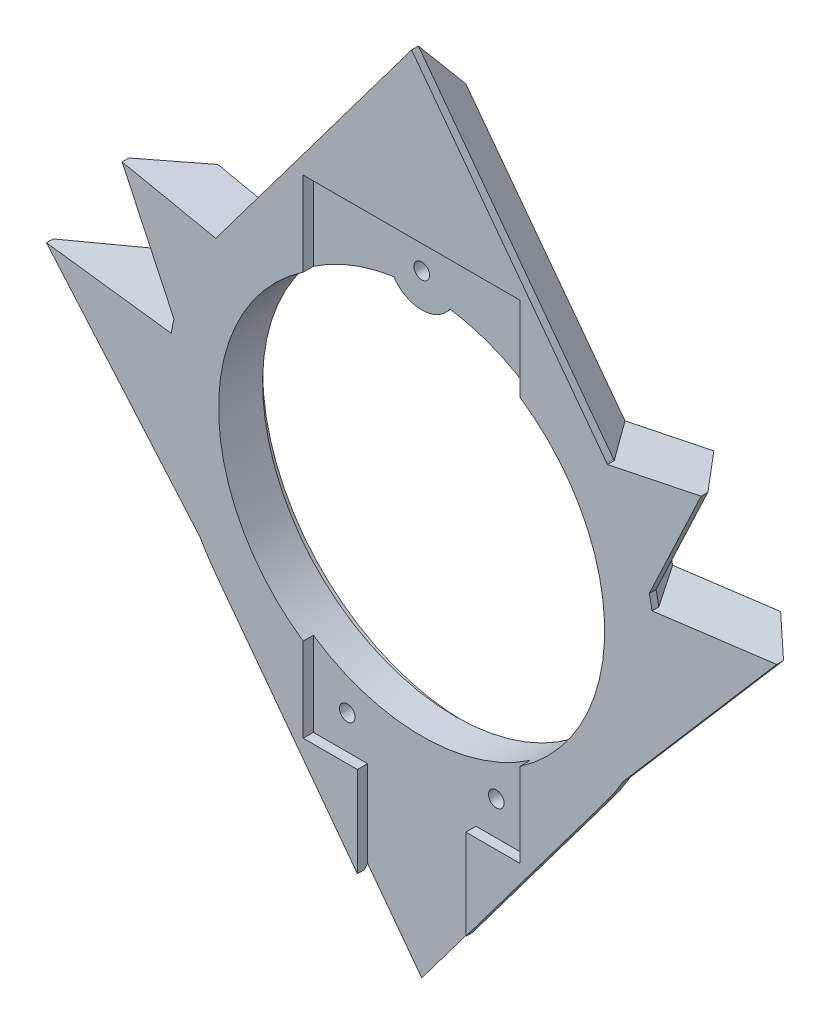
from build123d import *
from OCP.BRepFilletAPI import BRepFilletAPI_MakeChamfer

# Parameters (mm, degrees)
EXTRUDE_1_DEPTH         = 8
CHAMFER_12_SIZE         = 7
CHAMFER_12_SIZE2        = 5
HOLE_WIZARD_M2_22_D     = 2.3
HOLE_WIZARD_M2_22_DEPTH = 3.5
HOLE_WIZARD_M2_22_TIP   = 0.690989712
SKETCH_11_R             = 30
CUT_EXTRUDE_1_DEPTH     = 1.5
EXTRUDE_5_DEPTH         = 8
EXTRUDE_5_2_DEPTH       = 8
EXTRUDE_5_3_DEPTH       = 8
EXTRUDE_5_4_DEPTH       = 8
CHAMFER_13_SIZE         = 5
CHAMFER_13_SIZE2        = 7
CHAMFER_14_SIZE         = 5
CHAMFER_14_SIZE2        = 7
CHAMFER_15_SIZE         = 7
CHAMFER_15_SIZE2        = 5
CHAMFER_16_SIZE         = 5
CHAMFER_16_SIZE2        = 7
SKETCH_23_W             = 32
SKETCH_23_H             = 72
CUT_EXTRUDE_7_DEPTH     = 1.5
SKETCH_13_W             = 16
SKETCH_13_H             = 24
CUT_EXTRUDE_2_DEPTH     = 1.5


with BuildPart() as part:
    # Эскиз1 → Бобышка-Вытянуть1 (new body)
    with BuildSketch(Plane.XY):
        with BuildLine():
            Line((28.8, 21.6), (0, 60))
            Line((0, 60), (-28.8, 21.6))
            ThreePointArc((-28.8, 21.6), (-36, 0), (-28.8, -21.6))
            Line((-28.8, -21.6), (0, -60))
            Line((0, -60), (28.8, -21.6))
            ThreePointArc((28.8, -21.6), (36, 0), (28.8, 21.6))
        make_face()
        with BuildLine():
            ThreePointArc((4.1408267, 28.197580645), (0, -28.5), (-4.1408267, 28.197580645))
            ThreePointArc((-4.1408267, 28.197580645), (0, 26), (4.1408267, 28.197580645))
        make_face(mode=Mode.SUBTRACT)
    extrude(amount=EXTRUDE_1_DEPTH)

    # Фаска12: one chamfer whose edges measure the first distance from different faces: ONE call of the kernel's chamfer builder (chamfer() names one face for all edges)
    chamfer_12_edges_1 = [part.edges().sort_by_distance(p)[0] for p in [
        (14.4, 40.8, 0),
    ]]
    chamfer_12_side_1 = [part.faces().sort_by_distance(p)[0] for p in [
        (14.4, 40.8, 4),
    ]]
    chamfer_12_edges_2 = [part.edges().sort_by_distance(p)[0] for p in [
        (36, 0, 0),
    ]]
    chamfer_12_side_2 = [part.faces().sort_by_distance(p)[0] for p in [
        (36, 0, 4),
    ]]
    chamfer_12_edges_3 = [part.edges().sort_by_distance(p)[0] for p in [
        (14.4, -40.8, 0),
    ]]
    chamfer_12_side_3 = [part.faces().sort_by_distance(p)[0] for p in [
        (14.4, -40.8, 4),
    ]]
    chamfer_12_edges_4 = [part.edges().sort_by_distance(p)[0] for p in [
        (-14.4, -40.8, 0),
    ]]
    chamfer_12_side_4 = [part.faces().sort_by_distance(p)[0] for p in [
        (-14.4, -40.8, 4),
    ]]
    chamfer_12_edges_5 = [part.edges().sort_by_distance(p)[0] for p in [
        (-36, 0, 0),
    ]]
    chamfer_12_side_5 = [part.faces().sort_by_distance(p)[0] for p in [
        (-36, 0, 4),
    ]]
    chamfer_12_edges_6 = [part.edges().sort_by_distance(p)[0] for p in [
        (-14.4, 40.8, 0),
    ]]
    chamfer_12_side_6 = [part.faces().sort_by_distance(p)[0] for p in [
        (-14.4, 40.8, 4),
    ]]
    chamfer_12 = BRepFilletAPI_MakeChamfer(part.part.solid().wrapped)
    for e in chamfer_12_edges_1:
        chamfer_12.Add(CHAMFER_12_SIZE, CHAMFER_12_SIZE2, e.wrapped, chamfer_12_side_1[0].wrapped)  # the first distance lies on this face
    for e in chamfer_12_edges_2:
        chamfer_12.Add(CHAMFER_12_SIZE, CHAMFER_12_SIZE2, e.wrapped, chamfer_12_side_2[0].wrapped)  # the first distance lies on this face
    for e in chamfer_12_edges_3:
        chamfer_12.Add(CHAMFER_12_SIZE, CHAMFER_12_SIZE2, e.wrapped, chamfer_12_side_3[0].wrapped)  # the first distance lies on this face
    for e in chamfer_12_edges_4:
        chamfer_12.Add(CHAMFER_12_SIZE, CHAMFER_12_SIZE2, e.wrapped, chamfer_12_side_4[0].wrapped)  # the first distance lies on this face
    for e in chamfer_12_edges_5:
        chamfer_12.Add(CHAMFER_12_SIZE, CHAMFER_12_SIZE2, e.wrapped, chamfer_12_side_5[0].wrapped)  # the first distance lies on this face
    for e in chamfer_12_edges_6:
        chamfer_12.Add(CHAMFER_12_SIZE, CHAMFER_12_SIZE2, e.wrapped, chamfer_12_side_6[0].wrapped)  # the first distance lies on this face
    add(Compound.cast(chamfer_12.Shape()), mode=Mode.REPLACE)

    # Hole Wizard M2.22
    with Locations(Plane.XY.offset(8)):
        with Locations((0, 31), (-11, -31), (11, -31)):
            Hole(HOLE_WIZARD_M2_22_D / 2, depth=HOLE_WIZARD_M2_22_DEPTH)
            with Locations((0, 0, -(HOLE_WIZARD_M2_22_DEPTH + HOLE_WIZARD_M2_22_TIP / 2))):  # 118° drill point
                Cone(0, HOLE_WIZARD_M2_22_D / 2, HOLE_WIZARD_M2_22_TIP, mode=Mode.SUBTRACT)

    # Эскиз11 → Вырез-Вытянуть1 (cut)
    with BuildSketch(Plane(origin=(0, 0, 0), x_dir=(-1, 0, 0), z_dir=(0, 0, -1))):
        Circle(SKETCH_11_R)
    extrude(amount=-CUT_EXTRUDE_1_DEPTH, mode=Mode.SUBTRACT)


with BuildPart() as body_2:
    # Эскиз17 → Бобышка-Вытянуть5 (new body)
    with BuildSketch(Plane(origin=(0, 0, 8), x_dir=(-1, 0, 0), z_dir=(0, 0, -1))):
        with BuildLine():
            Line((25.238858928, -18), (28.902564257, -20.612903226))
            Line((28.902564257, -20.612903226), (53.902564257, 8.387096774))
            Line((53.902564257, 8.387096774), (30.528334189, 5.387096774))
            ThreePointArc((30.528334189, 5.387096774), (30.236303195, -6.838564841), (25.238858928, -18))
        make_face()
    extrude(amount=EXTRUDE_5_DEPTH)

    # Фаска13
    chamfer_13_edges = [body_2.edges().sort_by_distance(p)[0] for p in [
        (-41.402564257, -6.112903226, 0),
    ]]
    chamfer_13_side = [body_2.faces().sort_by_distance(p)[0] for p in [
        (-37.369612162, -3.153009871, 0),
    ]]
    chamfer(chamfer_13_edges, length=CHAMFER_13_SIZE, length2=CHAMFER_13_SIZE2, reference=chamfer_13_side[0])


with BuildPart() as body_3:
    # Эскиз17 → Extrude 5 2 (new body)
    with BuildSketch(Plane(origin=(0, 0, 8), x_dir=(-1, 0, 0), z_dir=(0, 0, -1))):
        with BuildLine():
            Line((-28.902564257, -20.612903226), (-25.238858928, -18))
            ThreePointArc((-25.238858928, -18), (-30.236303195, -6.838564841), (-30.528334189, 5.387096774))
            Line((-30.528334189, 5.387096774), (-53.902564257, 8.387096774))
            Line((-53.902564257, 8.387096774), (-28.902564257, -20.612903226))
        make_face()
    extrude(amount=EXTRUDE_5_2_DEPTH)

    # Фаска14
    chamfer_14_edges = [body_3.edges().sort_by_distance(p)[0] for p in [
        (41.402564257, -6.112903226, 0),
    ]]
    chamfer_14_side = [body_3.faces().sort_by_distance(p)[0] for p in [
        (37.369612162, -3.153009871, 0),
    ]]
    chamfer(chamfer_14_edges, length=CHAMFER_14_SIZE, length2=CHAMFER_14_SIZE2, reference=chamfer_14_side[0])


with BuildPart() as body_4:
    # Эскиз17 → Extrude 5 3 (new body)
    with BuildSketch(Plane(origin=(0, 0, 8), x_dir=(-1, 0, 0), z_dir=(0, 0, -1))):
        with BuildLine():
            ThreePointArc((23.416468646, 20.314255983), (27.763165047, 13.791543298), (30.334880827, 6.387096774))
            Line((30.334880827, 6.387096774), (34.73833127, 7.314255983))
            Line((34.73833127, 7.314255983), (42.73833127, 24.314255983))
            Line((42.73833127, 24.314255983), (23.416468646, 20.314255983))
        make_face()
    extrude(amount=EXTRUDE_5_3_DEPTH)

    # Фаска16
    chamfer_16_edges = [body_4.edges().sort_by_distance(p)[0] for p in [
        (-38.73833127, 15.814255983, 0),
    ]]
    chamfer_16_side = [body_4.faces().sort_by_distance(p)[0] for p in [
        (-33.199864657, 16.363314329, 0),
    ]]
    chamfer(chamfer_16_edges, length=CHAMFER_16_SIZE, length2=CHAMFER_16_SIZE2, reference=chamfer_16_side[0])


with BuildPart() as body_5:
    # Эскиз17 → Extrude 5 4 (new body)
    with BuildSketch(Plane(origin=(0, 0, 8), x_dir=(-1, 0, 0), z_dir=(0, 0, -1))):
        with BuildLine():
            Line((-34.73833127, 7.314255983), (-30.334880827, 6.387096774))
            ThreePointArc((-30.334880827, 6.387096774), (-27.763165047, 13.791543298), (-23.416468646, 20.314255983))
            Line((-23.416468646, 20.314255983), (-42.73833127, 24.314255983))
            Line((-42.73833127, 24.314255983), (-34.73833127, 7.314255983))
        make_face()
    extrude(amount=EXTRUDE_5_4_DEPTH)

    # Фаска15
    chamfer_15_edges = [body_5.edges().sort_by_distance(p)[0] for p in [
        (38.73833127, 15.814255983, 0),
    ]]
    chamfer_15_side = [body_5.faces().sort_by_distance(p)[0] for p in [
        (38.73833127, 15.814255983, 4),
    ]]
    chamfer(chamfer_15_edges, length=CHAMFER_15_SIZE, length2=CHAMFER_15_SIZE2, reference=chamfer_15_side[0])


with BuildPart() as body_2_1:
    add(body_2.part)

    # Combine 2: union body 3, body 5, body 4, part
    add(body_3.part)
    add(body_5.part)
    add(body_4.part)
    add(part.part)

    # Эскиз23 → Вырез-Вытянуть7 (cut)
    with BuildSketch(Plane.XY.offset(8)):
        Rectangle(SKETCH_23_W, SKETCH_23_H)
    extrude(amount=-CUT_EXTRUDE_7_DEPTH, mode=Mode.SUBTRACT)

    # Эскиз13 → Вырез-Вытянуть2 (cut)
    with BuildSketch(Plane.XY.offset(8)):
        with Locations((0, -48)):
            Rectangle(SKETCH_13_W, SKETCH_13_H)
    extrude(amount=-CUT_EXTRUDE_2_DEPTH, mode=Mode.SUBTRACT)


solid = body_2_1.part
